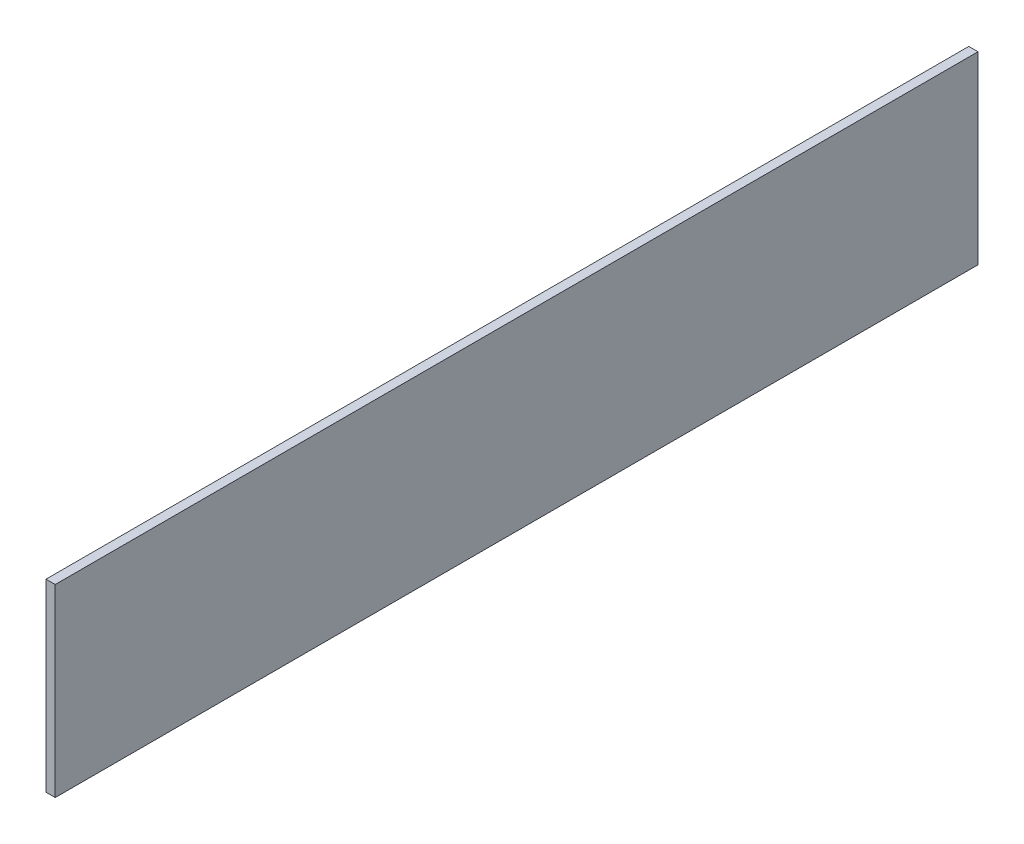
from build123d import *

# Parameters (mm, degrees)
ESQUISSE1_W        = 200
ESQUISSE1_H        = 40
BOSS_EXTRU_1_DEPTH = 2


with BuildPart() as part:
    # Esquisse1 → Boss.-Extru.1 (new body)
    with BuildSketch(Plane(origin=(0, 0, 0), x_dir=(0, 0, -1), z_dir=(1, 0, 0))):
        Rectangle(ESQUISSE1_W, ESQUISSE1_H)
    extrude(amount=BOSS_EXTRU_1_DEPTH)


solid = part.part
